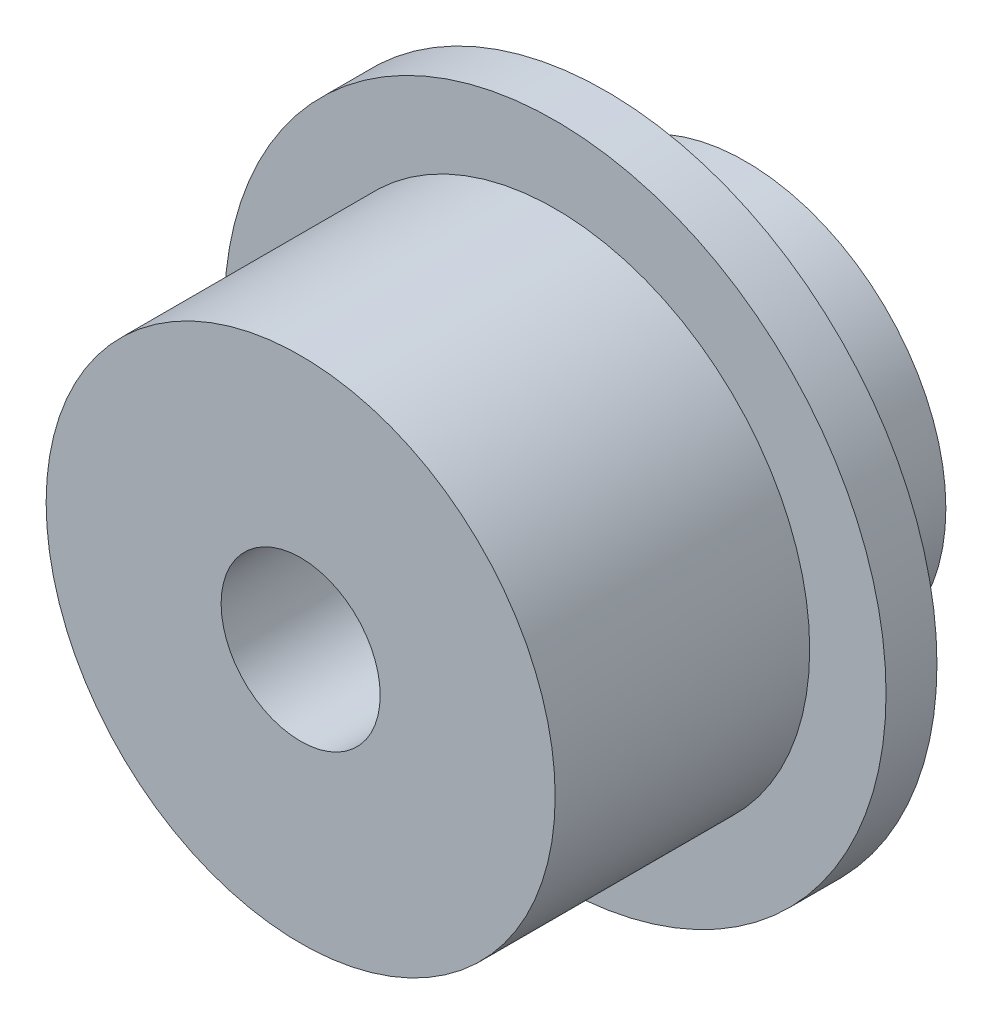
from build123d import *

# Parameters (mm, degrees)
SKETCH1_R           = 9.9949
BOSS_EXTRUDE1_DEPTH = 6.9596
SKETCH2_R           = 16.51
BOSS_EXTRUDE2_DEPTH = 2.54
SKETCH5_R           = 12.7
BOSS_EXTRUDE4_DEPTH = 12.7
SKETCH6_R           = 3.96875
CUT_EXTRUDE1_DEPTH  = 22.1996


with BuildPart() as part:
    # Sketch1 → Boss-Extrude1 (new body)
    with BuildSketch(Plane.XY):
        Circle(SKETCH1_R)
    extrude(amount=BOSS_EXTRUDE1_DEPTH)

    # Sketch2 → Boss-Extrude2 (add)
    with BuildSketch(Plane.XY.offset(6.9596)):
        Circle(SKETCH2_R)
    extrude(amount=BOSS_EXTRUDE2_DEPTH)

    # Sketch5 → Boss-Extrude4 (add)
    with BuildSketch(Plane.XY.offset(9.4996)):
        Circle(SKETCH5_R)
    extrude(amount=BOSS_EXTRUDE4_DEPTH)

    # Sketch6 → Cut-Extrude1 (cut)
    with BuildSketch(Plane(origin=(0, 0, 0), x_dir=(-1, 0, 0), z_dir=(0, 0, -1))):
        Circle(SKETCH6_R)
    extrude(amount=-CUT_EXTRUDE1_DEPTH, mode=Mode.SUBTRACT)


solid = part.part
